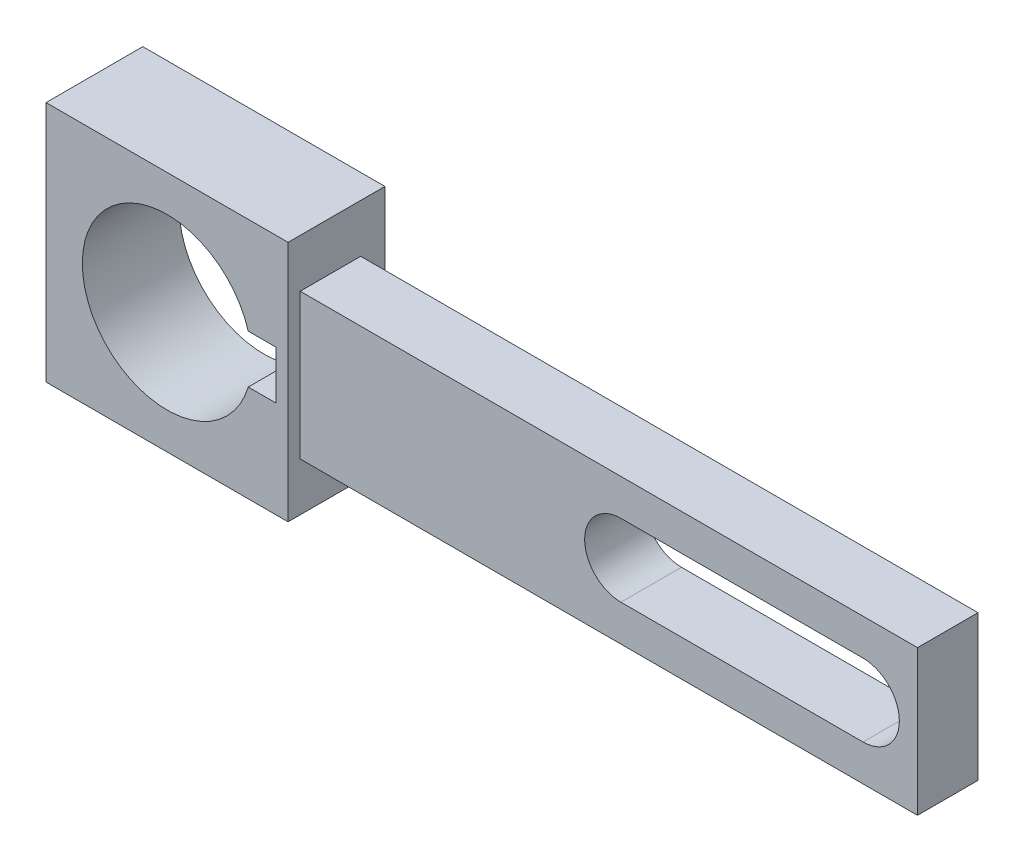
from build123d import *

# Parameters (mm, degrees)
SKETCH_1_W          = 20
SKETCH_1_H          = 20
EXTRUDE_2_DEPTH     = 8
SKETCH_2_W          = 5
SKETCH_2_H          = 12
EXTRUDE_3_DEPTH     = 51
CUT_EXTRUDE_1_DEPTH = 63.104750221


with BuildPart() as part:
    # 草图1 → 凸台-拉伸2 (new body)
    with BuildSketch(Plane.XY):
        Rectangle(SKETCH_1_W, SKETCH_1_H)
        with BuildLine():
            Line((6.708203932, -2), (9, -2))
            Line((9, -2), (9, 2))
            Line((9, 2), (6.708203932, 2))
            ThreePointArc((6.708203932, 2), (-7, 0), (6.708203932, -2))
        make_face(mode=Mode.SUBTRACT)
    extrude(amount=EXTRUDE_2_DEPTH)

    # 草图2 → 凸台-拉伸3 (add)
    with BuildSketch(Plane(origin=(10, 0, 0), x_dir=(0, 0, -1), z_dir=(1, 0, 0))):
        with Locations((-4.5, 0)):
            Rectangle(SKETCH_2_W, SKETCH_2_H)
    extrude(amount=EXTRUDE_3_DEPTH)

    # 草图3 → 切除-拉伸1 (cut, through all)
    with BuildSketch(Plane(origin=(0, 0, 2), x_dir=(-1, 0, 0), z_dir=(0, 0, -1))):
        with BuildLine():
            Line((-56.5, 3), (-36.5, 3))
            ThreePointArc((-36.5, 3), (-33.5, 0), (-36.5, -3))
            Line((-36.5, -3), (-56.5, -3))
            ThreePointArc((-56.5, -3), (-59.5, 0), (-56.5, 3))
        make_face()
    extrude(amount=-CUT_EXTRUDE_1_DEPTH, mode=Mode.SUBTRACT)


solid = part.part
